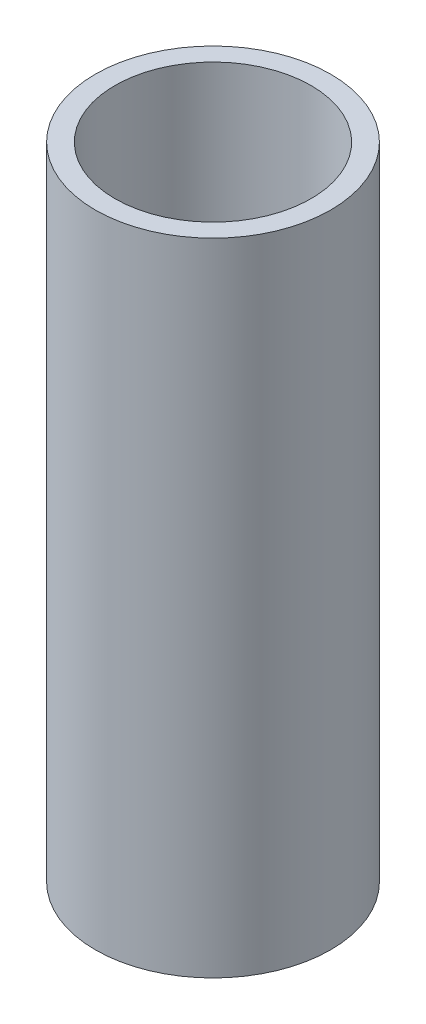
from build123d import *

# Parameters (mm, degrees)
SKETCH1_R           = 9
BOSS_EXTRUDE1_DEPTH = 49
SKETCH2_R           = 7.5
CUT_EXTRUDE1_DEPTH  = 47


with BuildPart() as part:
    # Sketch1 → Boss-Extrude1 (new body)
    with BuildSketch(Plane(origin=(0, 0, 0), x_dir=(1, 0, 0), z_dir=(0, 1, 0))):
        with Locations(Location((0, 0, 0), (0, 0, 270))):
            Circle(SKETCH1_R)
    extrude(amount=BOSS_EXTRUDE1_DEPTH)

    # Sketch2 → Cut-Extrude1 (cut)
    with BuildSketch(Plane(origin=(0, 49, 0), x_dir=(1, 0, 0), z_dir=(0, 1, 0))):
        with Locations(Location((0, 0, 0), (0, 0, 270))):
            Circle(SKETCH2_R)
    extrude(amount=-CUT_EXTRUDE1_DEPTH, mode=Mode.SUBTRACT)


solid = part.part
